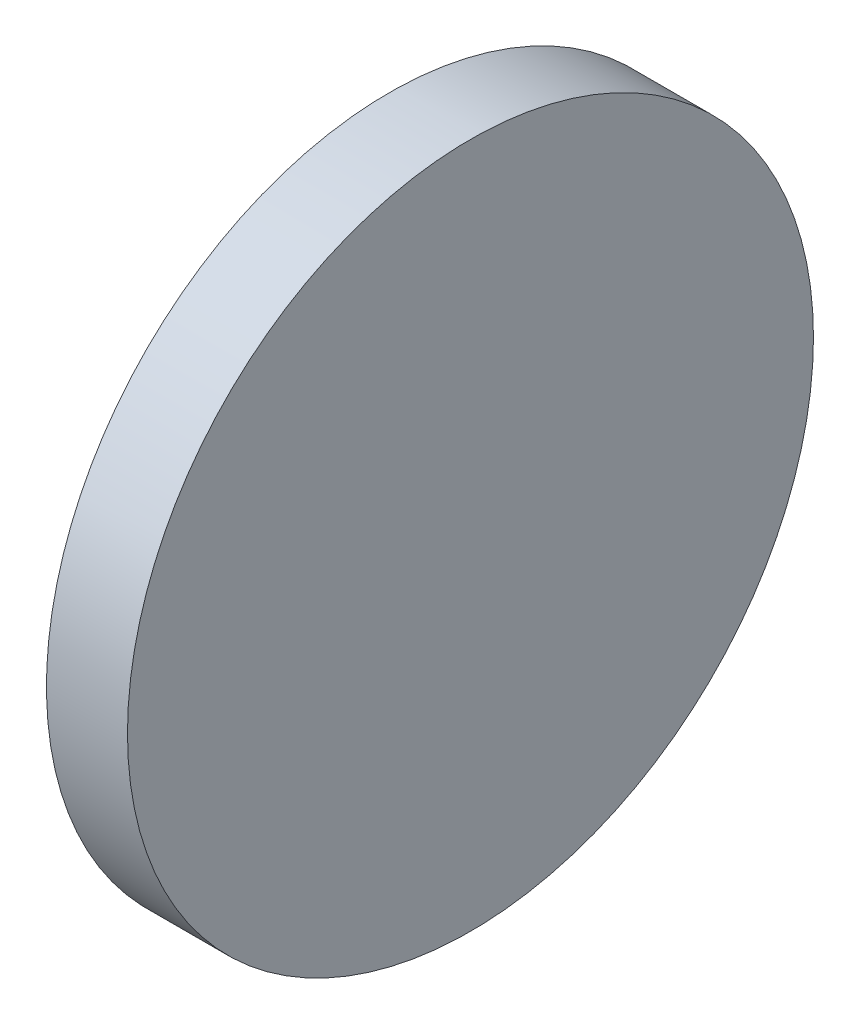
from build123d import *


with BuildPart() as part:
    # Sketch2 → Revolve3 (revolve)
    with BuildSketch(Plane.XY, mode=Mode.PRIVATE) as revolve3_sk:
        with BuildLine():
            Line((0, 0), (0, 12.7))
            Line((0, 12.7), (-4.3, 12.7))
            ThreePointArc((-4.3, 12.7), (-3.974153092, 6.316818975), (-3, 0))
            Line((-3, 0), (0, 0))
        make_face()
    revolve(revolve3_sk.sketch.rotate(Axis((23.723857868, 12.7, 0), (-1, 0, 0)), 270), axis=Axis((23.723857868, 12.7, 0), (-1, 0, 0)))


solid = part.part
